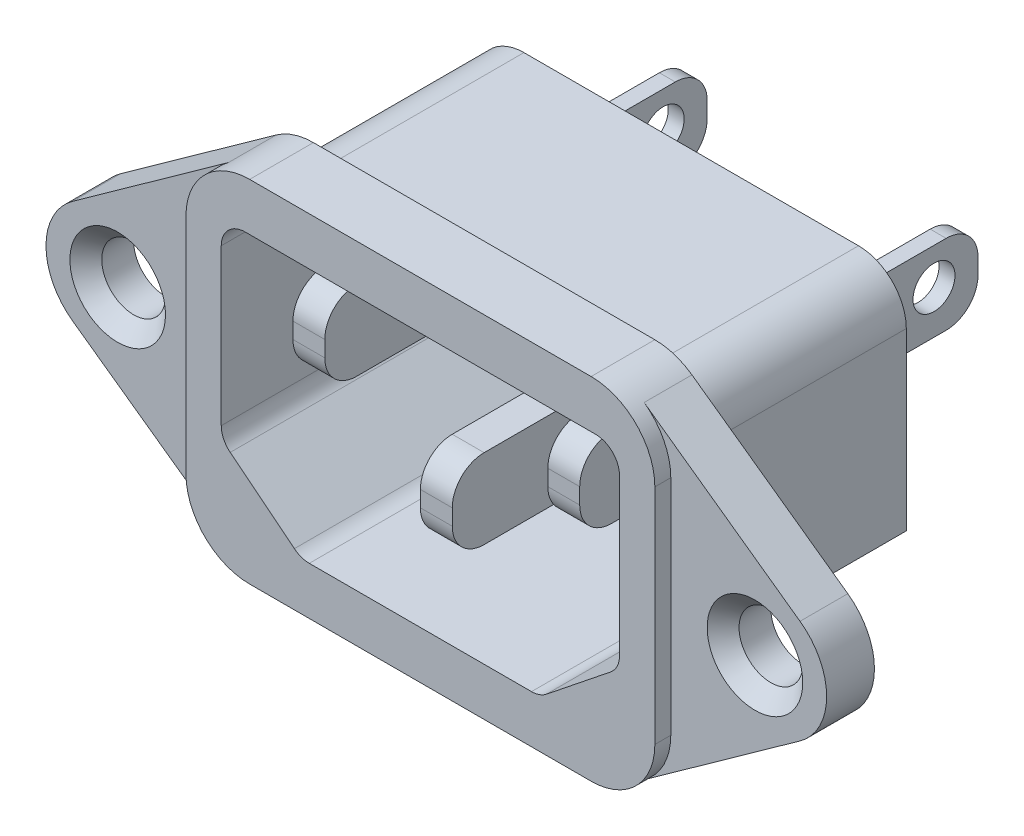
from build123d import *

# Parameters (mm, degrees)
EXTRUDE_1_DEPTH     = 13
EXTRUDE_2_DEPTH     = 3
EXTRUDE_3_DEPTH     = 1
CUT_EXTRUDE_1_DEPTH = 16
SKETCH_5_W          = 2
SKETCH_5_H          = 5
EXTRUDE_4_DEPTH     = 15
FILLET_1_R          = 2
SKETCH_6_W          = 1.000000004
SKETCH_6_H          = 5
SKETCH_6_W_2        = 0.999999996
SKETCH_6_W_3        = 1
EXTRUDE_5_DEPTH     = 9
SKETCH_7_W          = 2.859887346
SKETCH_7_H          = 6.332607693
SKETCH_7_W_2        = 2.383674024
SKETCH_7_H_2        = 6.268510199
SKETCH_7_W_3        = 2.540472095
SKETCH_7_H_3        = 6.351983774
EXTRUDE_7_DEPTH     = 1.5
SKETCH_8_R          = 1.317694444
CUT_EXTRUDE_2_DEPTH = 21.5
SKETCH_9_R          = 1.323361973
CUT_EXTRUDE_3_DEPTH = 3.5
FILLET_2_R          = 2
SKETCH_10_R         = 2
CUT_EXTRUDE_4_DEPTH = 3.5
SKETCH_11_R         = 2
CUT_EXTRUDE_5_DEPTH = 3.5
CHAMFER_1_SIZE      = 1


with BuildPart() as part:
    # Эскиз1 → Бобышка-Вытянуть1 (new body)
    with BuildSketch(Plane.XY):
        with BuildLine():
            Line((-24.03751348, 4.570186882), (-3.03751348, 4.570186882))
            ThreePointArc((-3.03751348, 4.570186882), (-0.916193137, 3.691507225), (-0.03751348, 1.570186882))
            Line((-0.03751348, 1.570186882), (-0.03751348, -9.429813118))
            Line((-0.03751348, -9.429813118), (-5.53751348, -14.429813118))
            Line((-5.53751348, -14.429813118), (-21.53751348, -14.429813118))
            Line((-21.53751348, -14.429813118), (-27.03751348, -9.429813118))
            Line((-27.03751348, -9.429813118), (-27.03751348, 1.570186882))
            ThreePointArc((-27.03751348, 1.570186882), (-26.158833824, 3.691507225), (-24.03751348, 4.570186882))
        make_face()
    extrude(amount=EXTRUDE_1_DEPTH)

    # Эскиз2 → Бобышка-Вытянуть2 (add)
    with BuildSketch(Plane.XY.offset(13)):
        with BuildLine():
            Line((-24.253629022, 6.070186882), (-2.821397929, 6.070186882))
            ThreePointArc((-2.821397929, 6.070186882), (-1.598940451, 5.87880838), (-0.493459013, 5.322985739))
            Line((-0.493459013, 5.322985739), (9.290425441, -1.679071989))
            ThreePointArc((9.290425441, -1.679071989), (10.962486488, -4.932373697), (9.289607579, -8.185254927))
            Line((9.289607579, -8.185254927), (-0.493722264, -15.183197119))
            ThreePointArc((-0.493722264, -15.183197119), (-1.598864627, -15.738588249), (-2.820843349, -15.929813118))
            Line((-2.820843349, -15.929813118), (-24.254183602, -15.929813118))
            ThreePointArc((-24.254183602, -15.929813118), (-25.476162332, -15.738588247), (-26.5813047, -15.183197109))
            Line((-26.5813047, -15.183197109), (-36.364634505, -8.185254887))
            ThreePointArc((-36.364634505, -8.185254887), (-38.037513448, -4.932373739), (-36.365452436, -1.679072079))
            Line((-36.365452436, -1.679072079), (-26.581567951, 5.322985729))
            ThreePointArc((-26.581567951, 5.322985729), (-25.476086508, 5.878808377), (-24.253629022, 6.070186882))
        make_face()
    extrude(amount=EXTRUDE_2_DEPTH)

    # Эскиз3 → Бобышка-Вытянуть3 (add)
    with BuildSketch(Plane.XY.offset(16)):
        with BuildLine():
            Line((-24.254183602, -15.929813118), (-2.820843349, -15.929813118))
            ThreePointArc((-2.820843349, -15.929813118), (0.007639796, -14.758184221), (1.179156647, -11.929654667))
            Line((1.179156647, -11.929654667), (1.178602071, 2.070186882))
            ThreePointArc((1.178602071, 2.070186882), (0.007029196, 4.898614007), (-2.821397929, 6.070186882))
            Line((-2.821397929, 6.070186882), (-24.253629022, 6.070186882))
            ThreePointArc((-24.253629022, 6.070186882), (-27.082056147, 4.898614007), (-28.253629022, 2.070186882))
            Line((-28.253629022, 2.070186882), (-28.254183602, -11.929813118))
            ThreePointArc((-28.254183602, -11.929813118), (-27.082610727, -14.758240243), (-24.254183602, -15.929813118))
        make_face()
    extrude(amount=EXTRUDE_3_DEPTH)

    # Эскиз4 → Вырез-Вытянуть1 (cut)
    with BuildSketch(Plane.XY.offset(17)):
        with BuildLine():
            Line((-24.537513476, 3.070186882), (-2.537513476, 3.070186882))
            ThreePointArc((-2.537513476, 3.070186882), (-1.476853304, 2.630847054), (-1.037513476, 1.570186882))
            Line((-1.037513476, 1.570186882), (-1.037513476, -8.208875847))
            ThreePointArc((-1.037513476, -8.208875847), (-1.185558621, -8.858658943), (-1.600470904, -9.380179061))
            Line((-1.600470904, -9.380179061), (-5.626642493, -12.601116332))
            ThreePointArc((-5.626642493, -12.601116332), (-6.067174653, -12.845255597), (-6.563685065, -12.929813118))
            Line((-6.563685065, -12.929813118), (-20.511341887, -12.929813118))
            ThreePointArc((-20.511341887, -12.929813118), (-21.007852299, -12.845255597), (-21.448384458, -12.601116332))
            Line((-21.448384458, -12.601116332), (-25.474556047, -9.380179061))
            ThreePointArc((-25.474556047, -9.380179061), (-25.88946833, -8.858658943), (-26.037513476, -8.208875847))
            Line((-26.037513476, -8.208875847), (-26.037513476, 1.570186882))
            ThreePointArc((-26.037513476, 1.570186882), (-25.598173647, 2.630847054), (-24.537513476, 3.070186882))
        make_face()
    extrude(amount=-CUT_EXTRUDE_1_DEPTH, mode=Mode.SUBTRACT)

    # Эскиз5 → Бобышка-Вытянуть4 (add)
    with BuildSketch(Plane.XY.offset(1)):
        with Locations((-21.537513476, -1.775325657)):
            Rectangle(SKETCH_5_W, SKETCH_5_H)
        with Locations((-13.537513476, -6.926056238)):
            Rectangle(SKETCH_5_W, SKETCH_5_H)
        with Locations((-5.537513476, -1.775325657)):
            Rectangle(SKETCH_5_W, SKETCH_5_H)
    extrude(amount=EXTRUDE_4_DEPTH)

    # Скругление1
    fillet_1_edges = [part.edges().sort_by_distance(p)[0] for p in [
        (-21.537513476, -4.275325657, 16),
        (-21.537513476, 0.724674343, 16),
        (-13.537513476, -9.426056238, 16),
        (-13.537513476, -4.426056238, 16),
        (-5.537513476, -4.275325657, 16),
        (-5.537513476, 0.724674343, 16),
    ]]
    fillet(fillet_1_edges, radius=FILLET_1_R)

    # Эскиз6 → Бобышка-Вытянуть5 (add)
    with BuildSketch(Plane(origin=(0, 0, 0), x_dir=(-1, 0, 0), z_dir=(0, 0, -1))):
        with Locations((5.037513478, -1.775325657)):
            Rectangle(SKETCH_6_W, SKETCH_6_H)
        with Locations((22.037513478, -1.775325657)):
            Rectangle(SKETCH_6_W_2, SKETCH_6_H)
        with Locations((13.628958145, -6.926056238)):
            Rectangle(SKETCH_6_W_3, SKETCH_6_H)
    extrude(amount=EXTRUDE_5_DEPTH)

    # Эскиз7 → Бобышка-Вытянуть7 (add)
    with BuildSketch(Plane(origin=(0, 0, 0), x_dir=(-1, 0, 0), z_dir=(0, 0, -1))):
        with Locations((5.059990277, -1.840113397)):
            Rectangle(SKETCH_7_W, SKETCH_7_H)
        with Locations((13.656892737, -6.928034415)):
            Rectangle(SKETCH_7_W_2, SKETCH_7_H_2)
        with Locations((22.046734018, -1.830425356)):
            Rectangle(SKETCH_7_W_3, SKETCH_7_H_3)
    extrude(amount=EXTRUDE_7_DEPTH)

    # Эскиз8 → Вырез-Вытянуть2 (cut)
    with BuildSketch(Plane(origin=(-4.537513476, 0, 0), x_dir=(0, 0, -1), z_dir=(1, 0, 0))):
        with Locations((6.23718035, -1.561929148)):
            Circle(SKETCH_8_R)
    extrude(amount=-CUT_EXTRUDE_2_DEPTH, mode=Mode.SUBTRACT)

    # Эскиз9 → Вырез-Вытянуть3 (cut)
    with BuildSketch(Plane(origin=(-13.128958145, 0, 0), x_dir=(0, 0, -1), z_dir=(1, 0, 0))):
        with Locations((6.266853337, -6.932739708)):
            Circle(SKETCH_9_R)
    extrude(amount=-CUT_EXTRUDE_3_DEPTH, mode=Mode.SUBTRACT)

    # Скругление2
    fillet_2_edges = [part.edges().sort_by_distance(p)[0] for p in [
        (-5.037513478, -4.275325657, -9),
        (-5.037513478, 0.724674343, -9),
        (-22.037513478, 0.724674343, -9),
        (-22.037513478, -4.275325657, -9),
        (-13.628958145, -9.426056238, -9),
        (-13.628958145, -4.426056238, -9),
    ]]
    fillet(fillet_2_edges, radius=FILLET_2_R)

    # Эскиз10 → Вырез-Вытянуть4 (cut)
    with BuildSketch(Plane.XY.offset(16)):
        with Locations((6.462486524, -4.931870875)):
            Circle(SKETCH_10_R)
    extrude(amount=-CUT_EXTRUDE_4_DEPTH, mode=Mode.SUBTRACT)

    # Эскиз11 → Вырез-Вытянуть5 (cut)
    with BuildSketch(Plane.XY.offset(16)):
        with Locations((-33.537513476, -4.931870875)):
            Circle(SKETCH_11_R)
    extrude(amount=-CUT_EXTRUDE_5_DEPTH, mode=Mode.SUBTRACT)

    # Фаска1
    chamfer_1_edges = [part.edges().sort_by_distance(p)[0] for p in [
        (4.462486524, -4.931870875, 16),
        (-35.537513476, -4.931870875, 16),
    ]]
    chamfer(chamfer_1_edges, length=CHAMFER_1_SIZE)


solid = part.part
